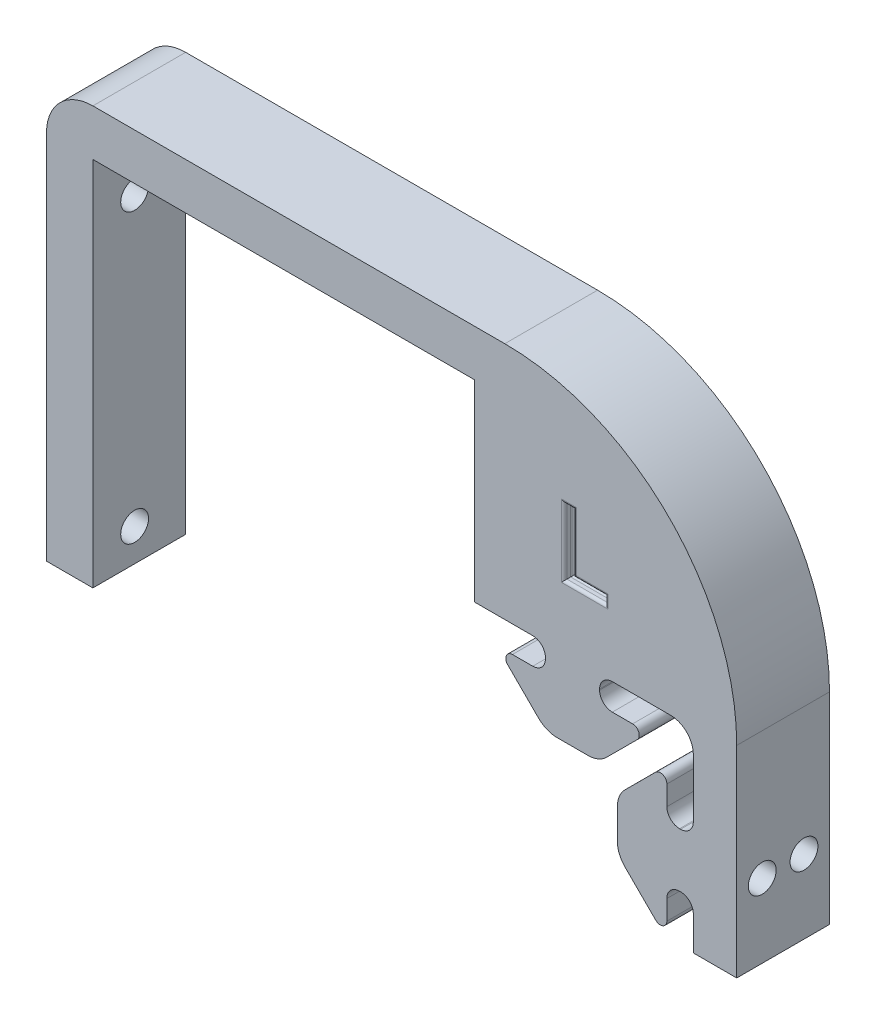
from build123d import *

# Parameters (mm, degrees)
BOSS_EXTRUDE1_DEPTH = 10
CUT_EXTRUDE1_REACH  = 86.489
SKETCH2_R           = 1.5
FILLET3_R           = 5
CUT_EXTRUDE2_REACH  = 86.489
SKETCH3_R           = 1.5
FILLET4_R           = 25
CUT_EXTRUDE7_DEPTH  = 1
FILLET8_R           = 0.3


with BuildPart() as part:
    # Sketch1 → Boss-Extrude1 (new body)
    with BuildSketch(Plane.XY):
        with BuildLine():
            Line((13.02, -7.9417418), (17.7, -7.9417418))
            Line((17.7, -7.9417418), (17.7, 38.77))
            Line((17.7, 38.77), (-56.7, 38.77))
            Line((-56.7, 38.77), (-56.7, -6.23))
            Line((-56.7, -6.23), (-51.7, -6.23))
            Line((-51.7, -6.23), (-51.7, 33.77))
            Line((-51.7, 33.77), (-10.566443095, 33.77))
            Line((-10.566443095, 33.77), (-10.566443095, 13.02))
            Line((-10.566443095, 13.02), (-5.317126718, 13.02))
            Line((-5.317126718, 13.02), (-4.287512407, 13.02))
            ThreePointArc((-4.287512407, 13.02), (-3.319474451, 12.619025549), (-2.9185, 11.650987593))
            Line((-2.9185, 11.650987593), (-2.9185, 11.539212407))
            ThreePointArc((-2.9185, 11.539212407), (-3.319474451, 10.571174451), (-4.287512407, 10.1702))
            Line((-4.287512407, 10.1702), (-6.476788598, 10.1702))
            ThreePointArc((-6.476788598, 10.1702), (-7.136510935, 9.729114651), (-6.981020848, 8.950903446))
            Line((-6.981020848, 8.950903446), (-3.672257405, 5.649701928))
            ThreePointArc((-3.672257405, 5.649701928), (-2.746830644, 5.032499411), (-1.655778399, 4.8158))
            Line((-1.655778399, 4.8158), (1.655778399, 4.8158))
            ThreePointArc((1.655778399, 4.8158), (2.746830644, 5.032499411), (3.672257405, 5.649701928))
            Line((3.672257405, 5.649701928), (6.981020848, 8.950903446))
            ThreePointArc((6.981020848, 8.950903446), (7.136510935, 9.729114651), (6.476788598, 10.1702))
            Line((6.476788598, 10.1702), (4.287512407, 10.1702))
            ThreePointArc((4.287512407, 10.1702), (3.319474451, 10.571174451), (2.9185, 11.539212407))
            Line((2.9185, 11.539212407), (2.9185, 11.650987593))
            ThreePointArc((2.9185, 11.650987593), (3.319474451, 12.619025549), (4.287512407, 13.02))
            Line((4.287512407, 13.02), (6.332886163, 13.02))
            Line((6.332886163, 13.02), (10.562594215, 13.019824354))
            ThreePointArc((10.562594215, 13.019824354), (12.303594776, 12.313982883), (13.019956614, 10.577284622))
            Line((13.019956614, 10.577284622), (13.02, 4.287469289))
            ThreePointArc((13.02, 4.287469289), (12.619025549, 3.319431332), (11.650987593, 2.918456882))
            Line((11.650987593, 2.918456882), (11.539212407, 2.918456882))
            ThreePointArc((11.539212407, 2.918456882), (10.571174451, 3.319431332), (10.1702, 4.287469289))
            Line((10.1702, 4.287469289), (10.1702, 6.402089023))
            ThreePointArc((10.1702, 6.402089023), (9.733877283, 7.055496588), (8.963146507, 6.90287605))
            Line((8.963146507, 6.90287605), (5.667020993, 3.614283579))
            ThreePointArc((5.667020993, 3.614283579), (5.046449321, 2.687255303), (4.8285, 1.593185507))
            Line((4.8285, 1.593185507), (4.8285, -1.593185507))
            ThreePointArc((4.8285, -1.593185507), (5.046449321, -2.687255303), (5.667020993, -3.614283579))
            Line((5.667020993, -3.614283579), (8.963146507, -6.90287605))
            ThreePointArc((8.963146507, -6.90287605), (9.733877283, -7.055496588), (10.1702, -6.402089023))
            Line((10.1702, -6.402089023), (10.1702, -4.287469289))
            ThreePointArc((10.1702, -4.287469289), (10.571174451, -3.319431332), (11.539212407, -2.918456882))
            Line((11.539212407, -2.918456882), (11.650987593, -2.918456882))
            ThreePointArc((11.650987593, -2.918456882), (12.619025549, -3.319431332), (13.02, -4.287469289))
            Line((13.02, -4.287469289), (13.02, -5.3170836))
            Line((13.02, -5.3170836), (13.02, -7.9417418))
        make_face()
    extrude(amount=BOSS_EXTRUDE1_DEPTH)

    # Sketch2 → Cut-Extrude1 (cut, up to next)
    with BuildSketch(Plane.ZY.offset(56.7), mode=Mode.PRIVATE) as cut_extrude1_sk1:
        with Locations((5.5, -2.73)):
            Circle(SKETCH2_R)
    cut_extrude1_tool1 = extrude(cut_extrude1_sk1.sketch, amount=-CUT_EXTRUDE1_REACH, mode=Mode.PRIVATE) & part.part
    # Sketch2 → Cut-Extrude1 (cut, up to next)
    with BuildSketch(Plane.ZY.offset(56.7), mode=Mode.PRIVATE) as cut_extrude1_sk2:
        with Locations((5.5, 28.27)):
            Circle(SKETCH2_R)
    cut_extrude1_tool2 = extrude(cut_extrude1_sk2.sketch, amount=-CUT_EXTRUDE1_REACH, mode=Mode.PRIVATE) & part.part
    add(cut_extrude1_tool1.solids().sort_by_distance((-56.7, -2.73, 5.5))[0], mode=Mode.SUBTRACT)
    add(cut_extrude1_tool2.solids().sort_by_distance((-56.7, 28.27, 5.5))[0], mode=Mode.SUBTRACT)

    # Fillet3
    fillet3_edges = [part.edges().sort_by_distance(p)[0] for p in [
        (-56.7, 38.77, 5),
    ]]
    fillet(fillet3_edges, radius=FILLET3_R)

    # Sketch3 → Cut-Extrude2 (cut, up to next)
    with BuildSketch(Plane(origin=(17.7, 0, 0), x_dir=(0, 0, -1), z_dir=(1, 0, 0)), mode=Mode.PRIVATE) as cut_extrude2_sk1:
        with Locations((-7.25, 0)):
            Circle(SKETCH3_R)
    cut_extrude2_tool1 = extrude(cut_extrude2_sk1.sketch, amount=-CUT_EXTRUDE2_REACH, mode=Mode.PRIVATE) & part.part
    # Sketch3 → Cut-Extrude2 (cut, up to next)
    with BuildSketch(Plane(origin=(17.7, 0, 0), x_dir=(0, 0, -1), z_dir=(1, 0, 0)), mode=Mode.PRIVATE) as cut_extrude2_sk2:
        with Locations(Location((-2.75, 0, 0), (0, 0, 90))):
            Circle(SKETCH3_R)
    cut_extrude2_tool2 = extrude(cut_extrude2_sk2.sketch, amount=-CUT_EXTRUDE2_REACH, mode=Mode.PRIVATE) & part.part
    add(cut_extrude2_tool1.solids().sort_by_distance((17.7, 0, 7.25))[0], mode=Mode.SUBTRACT)
    add(cut_extrude2_tool2.solids().sort_by_distance((17.7, 0, 2.75))[0], mode=Mode.SUBTRACT)

    # Fillet4
    fillet4_edges = [part.edges().sort_by_distance(p)[0] for p in [
        (17.7, 38.77, 5),
    ]]
    fillet(fillet4_edges, radius=FILLET4_R)

    # Sketch7 → Cut-Extrude7 (cut)
    with BuildSketch(Plane.XY.offset(10)):
        Polygon((-0.90100078, 19.84300121), (-0.90100078, 27.034293528), (0.113155829, 27.034293528), (0.113155829, 20.672765708), (3.524409877, 20.672765708), (3.524409877, 19.84300121), align=None)
    extrude(amount=-CUT_EXTRUDE7_DEPTH, mode=Mode.SUBTRACT)

    # Fillet8
    fillet8_edges = [part.edges().sort_by_distance(p)[0] for p in [
        (1.311704549, 19.84300121, 10),
        (-0.90100078, 23.438647369, 10),
        (-0.393922475, 27.034293528, 10),
        (0.113155829, 23.853529618, 10),
        (1.818782853, 20.672765708, 10),
        (3.524409877, 20.257883459, 10),
        (1.311704549, 19.84300121, 9),
        (-0.90100078, 23.438647369, 9),
        (-0.393922475, 27.034293528, 9),
        (0.113155829, 23.853529618, 9),
        (1.818782853, 20.672765708, 9),
        (3.524409877, 20.257883459, 9),
    ]]
    fillet(fillet8_edges, radius=FILLET8_R)


solid = part.part
